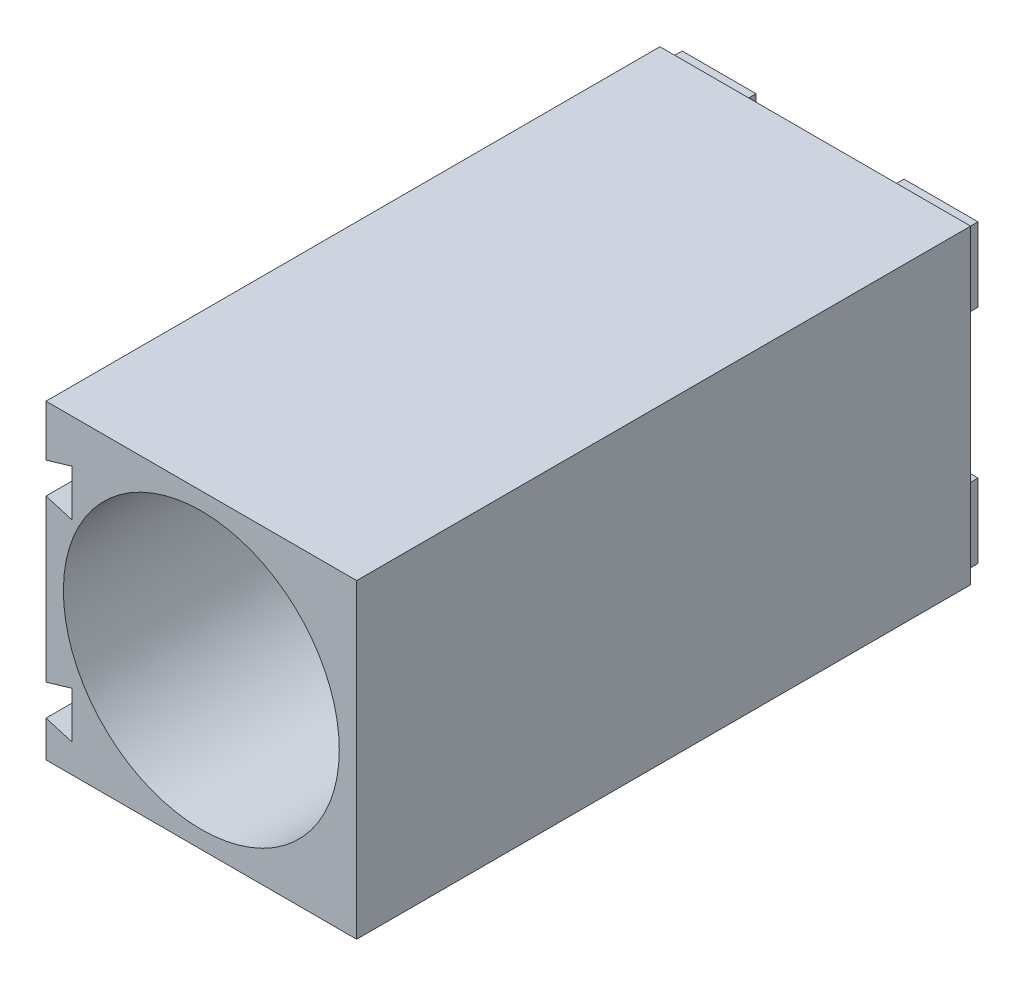
from build123d import *

# Parameters (mm, degrees)
CROQUIS1_W              = 21
CROQUIS1_H              = 21
CROQUIS1_R              = 9.325
SALIENTE_EXTRUIR1_DEPTH = 20.75
CROQUIS2_W              = 5
CROQUIS2_H              = 5
SALIENTE_EXTRUIR3_DEPTH = 1
CORTAR_EXTRUIR2_DEPTH   = 18
SALIENTE_EXTRUIR7_DEPTH = 8


with BuildPart() as part:
    # Croquis1 → Saliente-Extruir1 (new, symmetric)
    with BuildSketch(Plane.XY):
        Rectangle(CROQUIS1_W, CROQUIS1_H)
        Circle(CROQUIS1_R, mode=Mode.SUBTRACT)
    extrude(amount=SALIENTE_EXTRUIR1_DEPTH, both=True)

    # Croquis2 → Saliente-Extruir3 (add)
    with BuildSketch(Plane(origin=(0, 0, -20.75), x_dir=(-1, 0, 0), z_dir=(0, 0, -1))):
        with Locations((-7.5, 7.5)):
            Rectangle(CROQUIS2_W, CROQUIS2_H)
        with Locations((7.5, 7.5)):
            Rectangle(CROQUIS2_W, CROQUIS2_H)
        with Locations((7.5, -7.5)):
            Rectangle(CROQUIS2_W, CROQUIS2_H)
        with Locations((-7.5, -7.5)):
            Rectangle(CROQUIS2_W, CROQUIS2_H)
    extrude(amount=SALIENTE_EXTRUIR3_DEPTH)

    # Croquis8 → Cortar-Extruir2 (cut)
    with BuildSketch(Plane.XY.offset(20.75)):
        Polygon((-10.55, -5.962588103), (-8.75, -5.433176338), (-8.75, -8.566823662), (-10.55, -8.037411897), align=None)
        Polygon((-10.55, 7.037411897), (-10.55, 4.962588103), (-8.75, 4.433176338), (-8.75, 7.566823662), align=None)
    extrude(amount=-CORTAR_EXTRUIR2_DEPTH, mode=Mode.SUBTRACT)

    # Croquis9 → Saliente-Extruir7 (add)
    with BuildSketch(Plane(origin=(0, 0, -20.75), x_dir=(-1, 0, 0), z_dir=(0, 0, -1))):
        Polygon((6, -10.5), (8, -10.5), (8.5, -12.2), (5.5, -12.2), align=None)
        Polygon((-4.5, -12.2), (-5, -10.5), (-7, -10.5), (-7.5, -12.2), align=None)
    extrude(amount=-SALIENTE_EXTRUIR7_DEPTH)


solid = part.part
